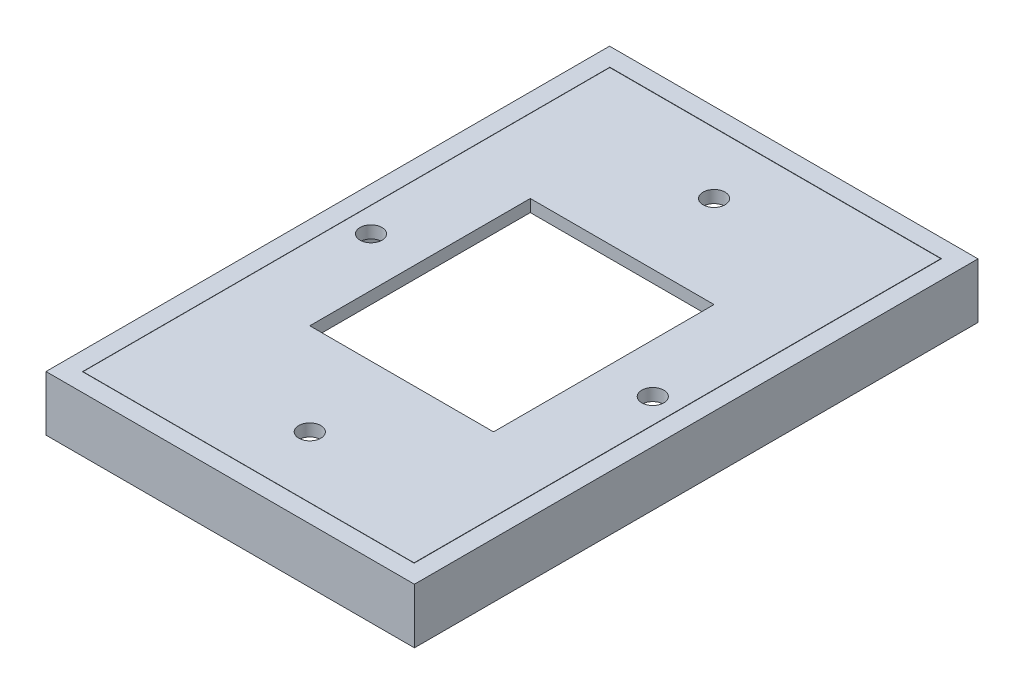
from build123d import *

# Parameters (mm, degrees)
SKETCH1_W                = 54.05
SKETCH1_H                = 86
SKETCH1_W_2              = 30
SKETCH1_H_2              = 36
BOSS_EXTRUDE1_DEPTH      = 2
BOSS_EXTRUDE2_DEPTH      = 7
BOSS_EXTRUDE2_DEPTH_BACK = 2
SKETCH2_W                = 60.15045032
SKETCH2_H                = 92.011080655
SKETCH2_W_2              = 54.15045032
SKETCH2_H_2              = 86.1
SKETCH3_R                = 1.8
CUT_EXTRUDE1_DEPTH       = 2


with BuildPart() as part:
    # Sketch1 → Boss-Extrude1 (new body)
    with BuildSketch(Plane(origin=(0, 0, 0), x_dir=(1, 0, 0), z_dir=(0, 1, 0))):
        Rectangle(SKETCH1_W, SKETCH1_H)
        Rectangle(SKETCH1_W_2, SKETCH1_H_2, mode=Mode.SUBTRACT)
    extrude(amount=BOSS_EXTRUDE1_DEPTH)

    # Sketch3 → Cut-Extrude1 (cut)
    with BuildSketch(Plane(origin=(0, 2, 0), x_dir=(1, 0, 0), z_dir=(0, 1, 0))):
        with Locations(Location((0, -33, 0), (0, 0, 270))):
            Circle(SKETCH3_R)
        with Locations(Location((-23, 0, 0), (0, 0, 270))):
            Circle(SKETCH3_R)
        with Locations(Location((0, 33, 0), (0, 0, 90))):
            Circle(SKETCH3_R)
        with Locations(Location((23, 0, 0), (0, 0, 90))):
            Circle(SKETCH3_R)
    extrude(amount=-CUT_EXTRUDE1_DEPTH, mode=Mode.SUBTRACT)


with BuildPart() as body_2:
    # Sketch2 → Boss-Extrude2 (new, two sides: drawn at the far end of the back side and taken through both)
    with BuildSketch(Plane.XZ.offset(-BOSS_EXTRUDE2_DEPTH_BACK)):
        with Locations((0.007495436, -0.005540328)):
            Rectangle(SKETCH2_W, SKETCH2_H)
        with Locations((0.007495436, -0.005540327)):
            Rectangle(SKETCH2_W_2, SKETCH2_H_2, mode=Mode.SUBTRACT)
    extrude(amount=BOSS_EXTRUDE2_DEPTH + BOSS_EXTRUDE2_DEPTH_BACK)


solid = Compound([part.part, body_2.part])
